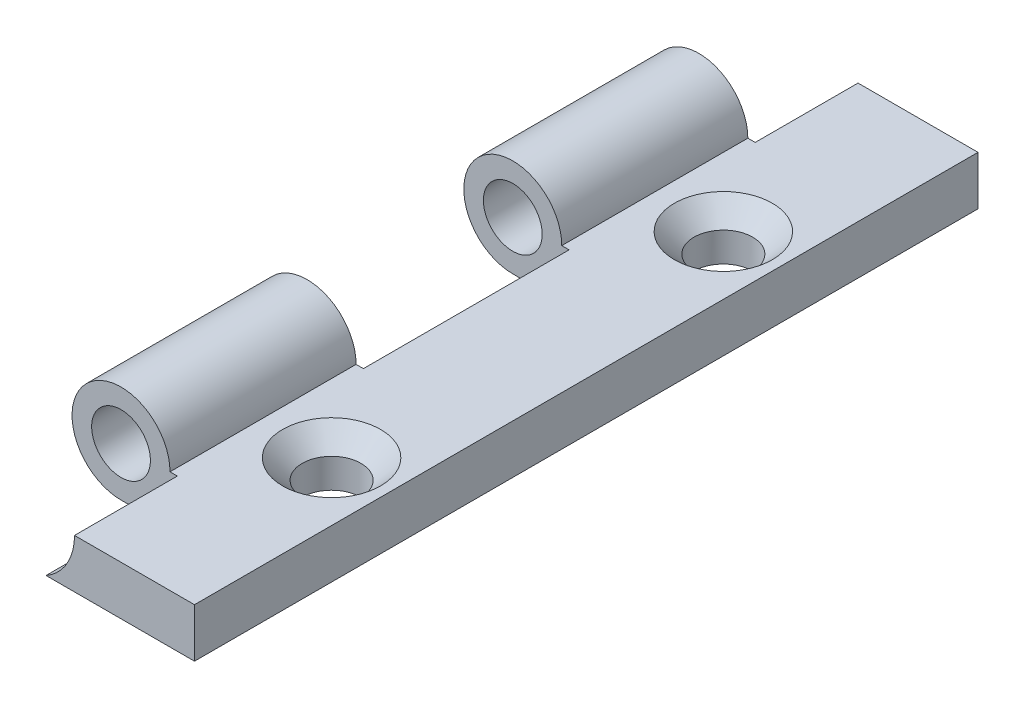
from build123d import *

# Parameters (mm, degrees)
SKETCH1_W           = 9
SKETCH1_H           = 40
BOSS_EXTRUDE1_DEPTH = 2.5
BOSS_EXTRUDE2_START = -5.25
SKETCH2_R           = 2.5
BOSS_EXTRUDE2_DEPTH = 9.5
SKETCH3_R           = 1.5
CUT_EXTRUDE1_DEPTH  = 42.919565837
SKETCH4_R           = 2.875
CUT_EXTRUDE2_DEPTH  = 5.25
CUT_EXTRUDE3_START  = -14.75
SKETCH4_2_R         = 2.875
CUT_EXTRUDE3_DEPTH  = 5.25
SKETCH5_R           = 1.5
CUT_EXTRUDE4_DEPTH  = 42.695323479
CHAMFER1_SIZE       = 1
CHAMFER2_SIZE       = 1


with BuildPart() as part:
    # Sketch1 → Boss-Extrude1 (new body)
    with BuildSketch(Plane(origin=(0, 0, 0), x_dir=(1, 0, 0), z_dir=(0, 1, 0))):
        with Locations((-4.5, 20)):
            Rectangle(SKETCH1_W, SKETCH1_H)
    extrude(amount=BOSS_EXTRUDE1_DEPTH)

    # Sketch2 → Boss-Extrude2 (add)
    with BuildSketch(Plane.XY.offset(BOSS_EXTRUDE2_START)):
        with Locations((-9, 2.5)):
            Circle(SKETCH2_R)
    boss_extrude2 = extrude(amount=-BOSS_EXTRUDE2_DEPTH)

    # Sketch3 → Cut-Extrude1 (cut, through all)
    with BuildSketch(Plane.XY):
        with Locations((-9, 2.5)):
            Circle(SKETCH3_R)
    cut_extrude1 = extrude(amount=-CUT_EXTRUDE1_DEPTH, mode=Mode.SUBTRACT)

    # Sketch4 → Cut-Extrude2 (cut)
    with BuildSketch(Plane.XY):
        with Locations((-9, 2.5)):
            Circle(SKETCH4_R)
    cut_extrude2 = extrude(amount=-CUT_EXTRUDE2_DEPTH, mode=Mode.SUBTRACT)

    # Sketch4<2> → Cut-Extrude3 (cut)
    with BuildSketch(Plane.XY.offset(CUT_EXTRUDE3_START)):
        with Locations((-9, 2.5)):
            Circle(SKETCH4_2_R)
    cut_extrude3 = extrude(amount=-CUT_EXTRUDE3_DEPTH, mode=Mode.SUBTRACT)

    # Mirror2: Boss-Extrude2, Cut-Extrude1, Cut-Extrude2, Cut-Extrude3 across plane
    add(boss_extrude2.mirror(Plane.XY.offset(-20)))
    add(cut_extrude1.mirror(Plane.XY.offset(-20)), mode=Mode.SUBTRACT)
    add(cut_extrude2.mirror(Plane.XY.offset(-20)), mode=Mode.SUBTRACT)
    add(cut_extrude3.mirror(Plane.XY.offset(-20)), mode=Mode.SUBTRACT)

    # Sketch5 → Cut-Extrude4 (cut, through all)
    with BuildSketch(Plane(origin=(0, 2.5, 0), x_dir=(1, 0, 0), z_dir=(0, 1, 0))):
        with Locations(Location((-3, 10, 0), (0, 0, 270))):
            Circle(SKETCH5_R)
    cut_extrude4 = extrude(amount=-CUT_EXTRUDE4_DEPTH, mode=Mode.SUBTRACT)

    # Mirror3: Cut-Extrude4 across plane
    add(cut_extrude4.mirror(Plane.XY.offset(-20)), mode=Mode.SUBTRACT)

    # Chamfer1
    chamfer1_edges = [part.edges().sort_by_distance(p)[0] for p in [
        (-3, 2.5, -28.5),
    ]]
    chamfer(chamfer1_edges, length=CHAMFER1_SIZE)

    # Chamfer2
    chamfer2_edges = [part.edges().sort_by_distance(p)[0] for p in [
        (-3, 2.5, -11.5),
    ]]
    chamfer(chamfer2_edges, length=CHAMFER2_SIZE)


solid = part.part
